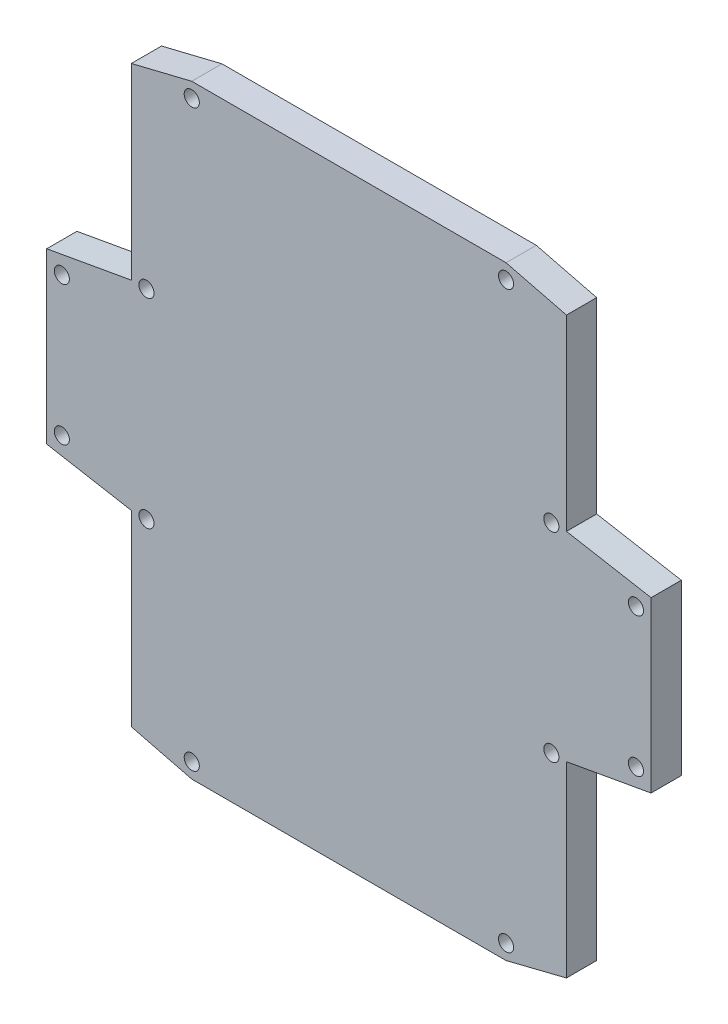
from build123d import *

# Parameters (mm, degrees)
BOSS_EXTRUDE2_DEPTH = 15
SKETCH2_W           = 3
SKETCH2_H           = 20
CUT_EXTRUDE2_DEPTH  = 10
SKETCH4_W           = 3
SKETCH4_H           = 20
BOSS_EXTRUDE5_DEPTH = 10
CUT_EXTRUDE3_DEPTH  = 5
SKETCH6_R           = 2.5
CUT_EXTRUDE4_DEPTH  = 6


with BuildPart() as part:
    # Sketch1 → Boss-Extrude2 (new body)
    with BuildSketch(Plane.XY):
        Polygon((-52, 100), (52, 100), (72, 95), (72, 33), (100, 28), (100, -28), (72, -33), (72, -95), (52, -100), (-52, -100), (-72, -95), (-72, -33), (-100, -28), (-100, 28), (-72, 33), (-72, 95.107401563), align=None)
    extrude(amount=BOSS_EXTRUDE2_DEPTH)

    # Sketch2 → Cut-Extrude2 (cut)
    with BuildSketch(Plane.XY.offset(15)):
        with Locations((-69.5, 80.352031484)):
            Rectangle(SKETCH2_W, SKETCH2_H)
        with Locations((-69.5, 43)):
            Rectangle(SKETCH2_W, SKETCH2_H)
    extrude(amount=-CUT_EXTRUDE2_DEPTH, mode=Mode.SUBTRACT)

    # Sketch4 → Boss-Extrude5 (add)
    with BuildSketch(Plane.XY.offset(15)):
        Polygon((-71, 90.352031484), (-68, 90.352031484), (-68, 70.352031484), (-69.5, 70.352031484), (-71, 70.352031484), align=None)
        with Locations((-69.5, 43)):
            Rectangle(SKETCH4_W, SKETCH4_H)
    extrude(amount=-BOSS_EXTRUDE5_DEPTH)

    # Sketch5 → Cut-Extrude3 (cut)
    with BuildSketch(Plane.XY.offset(15)):
        Polygon((-72, 95.107401563), (-72, 33), (-100, 28), (-100, -28), (-72, -33), (-72, -95), (-52, -100), (52, -100), (72, -95), (72, -33), (100, -28), (100, 28), (72, 33), (72, 95), (52, 100), (-52, 100), align=None)
    extrude(amount=-CUT_EXTRUDE3_DEPTH, mode=Mode.SUBTRACT)

    # Sketch6 → Cut-Extrude4 (cut)
    with BuildSketch(Plane.XY.offset(10)):
        with Locations((-52, 95.107401563)):
            Circle(SKETCH6_R)
        with Locations((-52, -95)):
            Circle(SKETCH6_R)
        with Locations((-67, -33)):
            Circle(SKETCH6_R)
        with Locations((-67, 33)):
            Circle(SKETCH6_R)
        with Locations((-95, 23)):
            Circle(SKETCH6_R)
        with Locations((-95, -23)):
            Circle(SKETCH6_R)
        with Locations(Location((95, -23, 0), (0, 0, 180))):
            Circle(SKETCH6_R)
        with Locations(Location((95, 23, 0), (0, 0, 180))):
            Circle(SKETCH6_R)
        with Locations(Location((67, 33, 0), (0, 0, 180))):
            Circle(SKETCH6_R)
        with Locations(Location((67, -33, 0), (0, 0, 180))):
            Circle(SKETCH6_R)
        with Locations(Location((52, -95, 0), (0, 0, 180))):
            Circle(SKETCH6_R)
        with Locations(Location((52, 95.107401563, 0), (0, 0, 180))):
            Circle(SKETCH6_R)
    extrude(amount=-CUT_EXTRUDE4_DEPTH, mode=Mode.SUBTRACT)


solid = part.part
